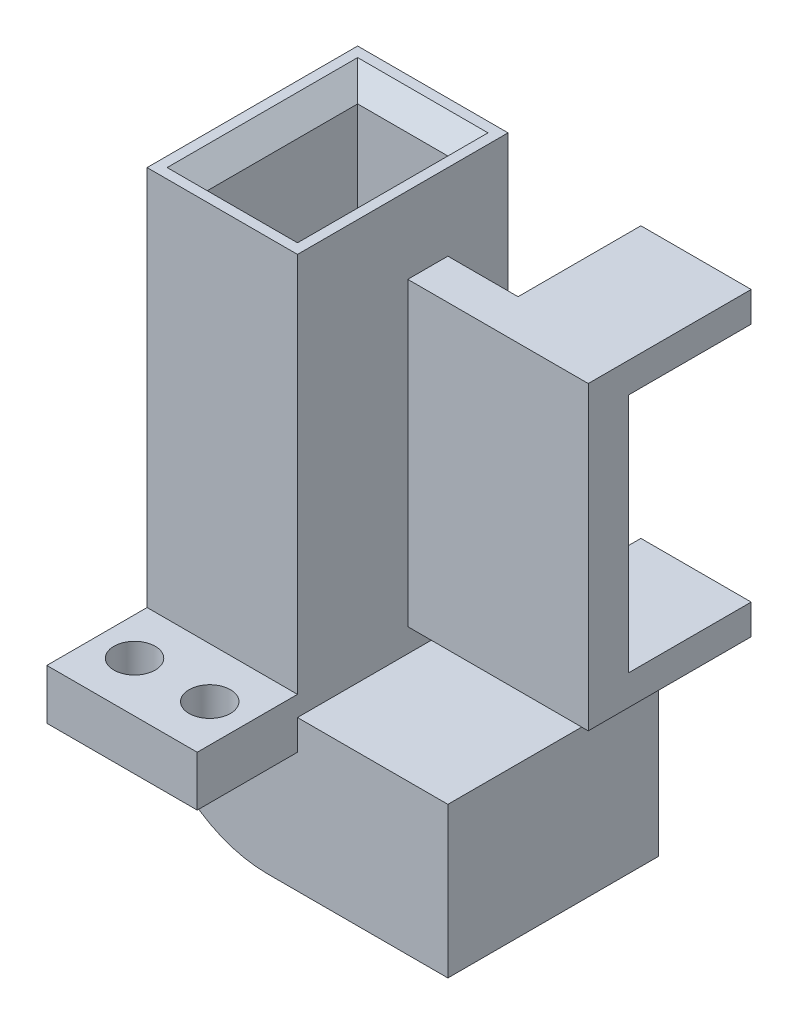
from build123d import *

# Parameters (mm, degrees)
BOSS_EXTRUDE1_DEPTH   = 15
BOSS_EXTRUDE1_2_DEPTH = 15
SKETCH2_W             = 9
SKETCH2_H             = 25
BOSS_EXTRUDE2_DEPTH   = 3
BOSS_EXTRUDE3_START   = 3
BOSS_EXTRUDE3_DEPTH   = 3
SKETCH4_W             = 3
SKETCH4_H             = 15.397275821
CUT_EXTRUDE1_DEPTH    = 6
BOSS_EXTRUDE4_DEPTH   = 18
SKETCH7_W             = 11
SKETCH7_H             = 3
BOSS_EXTRUDE5_DEPTH   = 12.25
CHAMFER1_SIZE         = 2
SKETCH8_W             = 15
SKETCH8_H             = 5
BOSS_EXTRUDE6_DEPTH   = 10
SKETCH9_R             = 2.0625
CUT_EXTRUDE2_DEPTH    = 52.662365412


with BuildPart() as part:
    # Sketch1 → Boss-Extrude1 (new body)
    with BuildSketch(Plane.XY):
        Polygon((0, 43), (0, 0), (15, 0), (15, -12), (18, -12), (18, 3), (3, 3), (3, 43), align=None)
    extrude(amount=BOSS_EXTRUDE1_DEPTH)



with BuildPart() as body_2:
    # Sketch1 → Boss-Extrude1 2 (new body)
    with BuildSketch(Plane.XY):
        with BuildLine():
            Line((0, -9), (0, -12))
            ThreePointArc((0, -12), (-8.485281374, -8.485281374), (-12, 0))
            Line((-12, 0), (-12, 43))
            Line((-12, 43), (-9, 43))
            Line((-9, 43), (-9, 0))
            ThreePointArc((-9, 0), (-6.363961031, -6.363961031), (0, -9))
        make_face()
    extrude(amount=BOSS_EXTRUDE1_2_DEPTH)


with BuildPart() as part_1:
    add(part.part)

    add(body_2.part)  # Boss-Extrude2 merges body 2
    # Sketch2 → Boss-Extrude2 (add)
    with BuildSketch(Plane(origin=(0, 0, 0), x_dir=(-1, 0, 0), z_dir=(0, 0, -1))):
        with BuildLine():
            Line((-3, 43), (12, 43))
            Line((12, 43), (12, 0))
            ThreePointArc((12, 0), (8.485281374, -8.485281374), (0, -12))
            Line((0, -12), (-18, -12))
            Line((-18, -12), (-18, 3))
            Line((-18, 3), (-3, 3))
            Line((-3, 3), (-3, 43))
        make_face()
        with Locations((4.5, 15.5)):
            Rectangle(SKETCH2_W, SKETCH2_H, mode=Mode.SUBTRACT)
    extrude(amount=BOSS_EXTRUDE2_DEPTH)

    # Sketch3 → Boss-Extrude3 (add)
    with BuildSketch(Plane.XY.offset(15).offset(BOSS_EXTRUDE3_START)):
        with BuildLine():
            Line((-12, 0), (-12, 43))
            Line((-12, 43), (3, 43))
            Line((3, 43), (3, 3))
            Line((3, 3), (18, 3))
            Line((18, 3), (18, -12))
            Line((18, -12), (0, -12))
            ThreePointArc((0, -12), (-8.485281374, -8.485281374), (-12, 0))
        make_face()
    extrude(amount=-BOSS_EXTRUDE3_DEPTH)

    # Sketch4 → Cut-Extrude1 (cut)
    with BuildSketch(Plane(origin=(0, 0, -3), x_dir=(-1, 0, 0), z_dir=(0, 0, -1))):
        with Locations((-1.5, 16.998637911)):
            Rectangle(SKETCH4_W, SKETCH4_H)
    extrude(amount=-CUT_EXTRUDE1_DEPTH, mode=Mode.SUBTRACT)

    # Sketch5 → Boss-Extrude4 (add)
    with BuildSketch(Plane(origin=(3, 0, 0), x_dir=(0, 0, -1), z_dir=(1, 0, 0))):
        Polygon((-3, 32.347275821), (-3, 8.347275821), (-3, 5.347275821), (-7, 5.347275821), (-7, 8.347275821), (-7, 32.347275821), (-7, 35.347275821), (-3, 35.347275821), align=None)
    extrude(amount=BOSS_EXTRUDE4_DEPTH)

    # Sketch7 → Boss-Extrude5 (add)
    with BuildSketch(Plane(origin=(0, 0, 3), x_dir=(-1, 0, 0), z_dir=(0, 0, -1))):
        with Locations((-15.5, 33.847275821)):
            Rectangle(SKETCH7_W, SKETCH7_H)
        with Locations((-15.5, 6.847275821)):
            Rectangle(SKETCH7_W, SKETCH7_H)
    extrude(amount=BOSS_EXTRUDE5_DEPTH)

    # Chamfer1
    chamfer1_edges = [part_1.edges().sort_by_distance(p)[0] for p in [
        (0, 43, 7.5),
        (-4.5, 43, 0),
        (-9, 43, 7.5),
        (-4.5, 43, 15),
    ]]
    chamfer(chamfer1_edges, length=CHAMFER1_SIZE)

    # Sketch8 → Boss-Extrude6 (add)
    with BuildSketch(Plane.XY.offset(18)):
        with Locations((-4.5, 2.5)):
            Rectangle(SKETCH8_W, SKETCH8_H)
    extrude(amount=BOSS_EXTRUDE6_DEPTH)

    # Sketch9 → Cut-Extrude2 (cut, through all)
    with BuildSketch(Plane(origin=(0, 5, 0), x_dir=(1, 0, 0), z_dir=(0, 1, 0))):
        with Locations(Location((-8.25, -23, 0), (0, 0, 270))):
            Circle(SKETCH9_R)
        with Locations(Location((-0.75, -23, 0), (0, 0, 270))):
            Circle(SKETCH9_R)
    extrude(amount=-CUT_EXTRUDE2_DEPTH, mode=Mode.SUBTRACT)


solid = part_1.part
